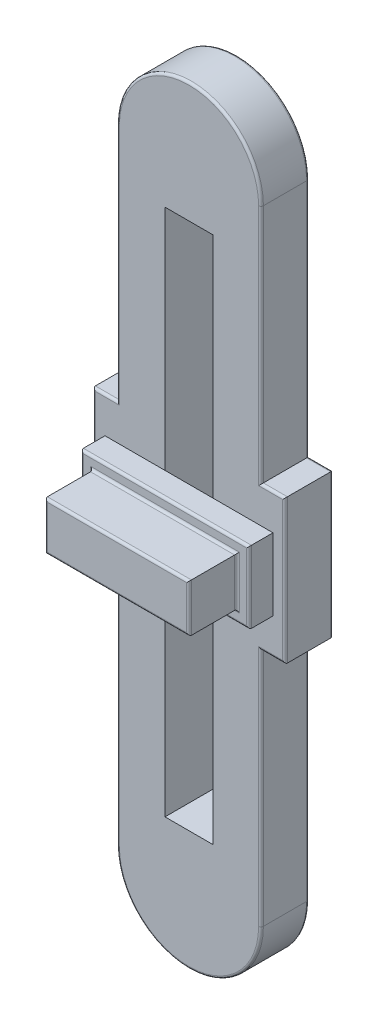
from build123d import *

# Parameters (mm, degrees)
SKETCH1_W           = 20
SKETCH1_H           = 220
BOSS_EXTRUDE1_DEPTH = 20
SKETCH2_W           = 60
SKETCH2_H           = 20
BOSS_EXTRUDE2_DEPTH = 30
SKETCH3_W           = 70
SKETCH3_H           = 30
SKETCH3_W_2         = 60
SKETCH3_H_2         = 20
BOSS_EXTRUDE3_DEPTH = 10
FILLET1_R           = 1
FILLET2_R           = 1


with BuildPart() as part:
    # Sketch1 → Boss-Extrude1 (new body)
    with BuildSketch(Plane.XY):
        with BuildLine():
            Line((30, 0), (30, -100))
            Line((30, -100), (40, -100))
            Line((40, -100), (40, -160))
            Line((40, -160), (30, -160))
            Line((30, -160), (30, -260))
            ThreePointArc((30, -260), (0, -290), (-30, -260))
            Line((-30, -260), (-30, -160))
            Line((-30, -160), (-40, -160))
            Line((-40, -160), (-40, -100))
            Line((-40, -100), (-30, -100))
            Line((-30, -100), (-30, 0))
            ThreePointArc((-30, 0), (0, 30), (30, 0))
        make_face()
        with Locations((0, -130)):
            Rectangle(SKETCH1_W, SKETCH1_H, mode=Mode.SUBTRACT)
    extrude(amount=BOSS_EXTRUDE1_DEPTH)

    # Sketch2 → Boss-Extrude2 (add)
    with BuildSketch(Plane.XY.offset(20)):
        with Locations((0, -130)):
            Rectangle(SKETCH2_W, SKETCH2_H)
    extrude(amount=BOSS_EXTRUDE2_DEPTH)

    # Sketch3 → Boss-Extrude3 (add)
    with BuildSketch(Plane.XY.offset(20)):
        with Locations((0, -130)):
            Rectangle(SKETCH3_W, SKETCH3_H)
        with Locations((0, -130)):
            Rectangle(SKETCH3_W_2, SKETCH3_H_2, mode=Mode.SUBTRACT)
    extrude(amount=BOSS_EXTRUDE3_DEPTH)

    # Fillet1
    fillet1_edges = [part.edges().sort_by_distance(p)[0] for p in [
        (30, -130, 50),
        (0, -120, 50),
        (-30, -130, 50),
        (0, -140, 50),
        (35, -130, 30),
        (0, -115, 30),
        (-35, -130, 30),
        (0, -145, 30),
        (0, -140, 30),
        (30, -130, 30),
        (0, -120, 30),
        (-30, -130, 30),
    ]]
    fillet(fillet1_edges, radius=FILLET1_R)

    # Fillet2
    fillet2_edges = [part.edges().sort_by_distance(p)[0] for p in [
        (30, -50, 0),
        (35, -100, 0),
        (-35, -100, 20),
        (40, -130, 0),
        (35, -160, 0),
        (30, -210, 0),
        (0, -290, 0),
        (-30, -210, 0),
        (-35, -160, 0),
        (-40, -130, 0),
        (-35, -100, 0),
        (-30, -50, 0),
        (0, 30, 0),
        (-40, -130, 20),
        (-35, -160, 20),
        (-30, -210, 20),
        (0, -290, 20),
        (30, -210, 20),
        (35, -160, 20),
        (40, -130, 20),
        (35, -100, 20),
        (30, -50, 20),
        (0, 30, 20),
        (-30, -50, 20),
    ]]
    fillet(fillet2_edges, radius=FILLET2_R)


solid = part.part
